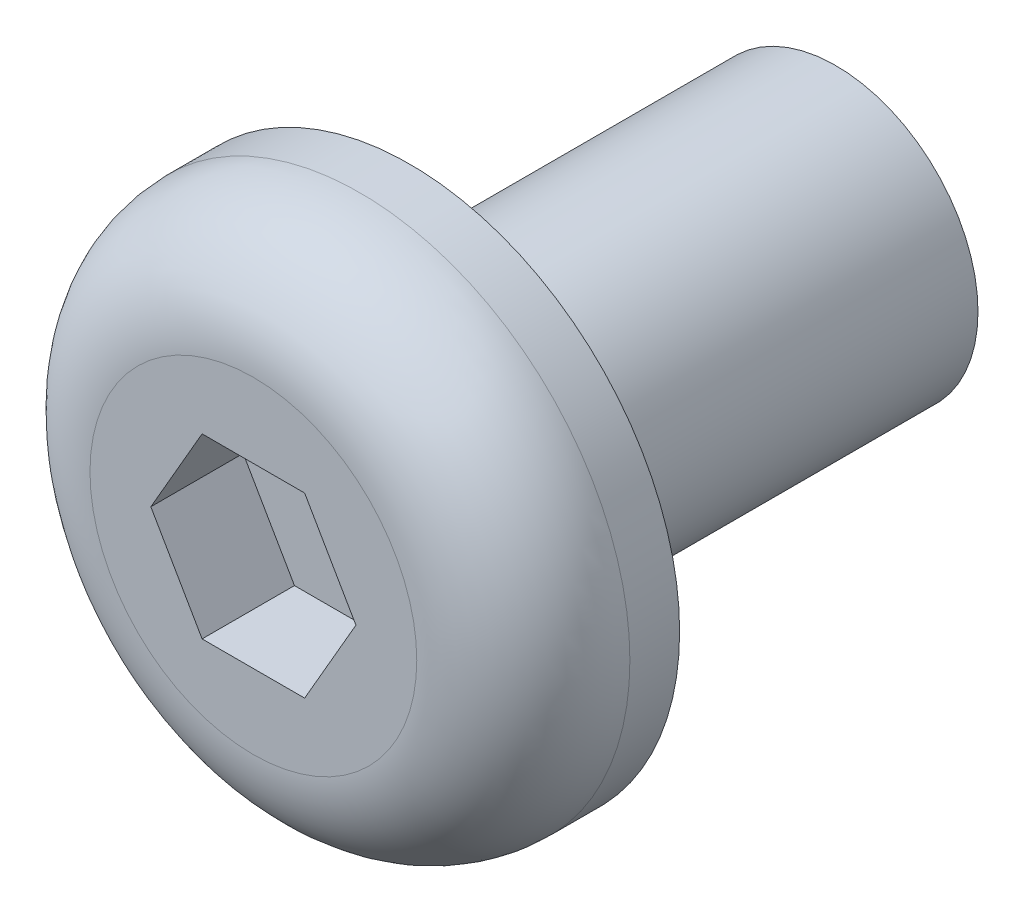
from build123d import *

# Parameters (mm, degrees)
SKETCH1_R      = 2
SHANK_DEPTH    = 6
SKETCH2_R      = 3.8
HEAD_DEPTH     = 2.2
BUTTON_ROUND_R = 1.5
SOCKET_DEPTH   = 1.3


with BuildPart() as part:
    # Sketch1 → Shank (new body)
    with BuildSketch(Plane.XY):
        Circle(SKETCH1_R)
    extrude(amount=SHANK_DEPTH)

    # Sketch2 → Head (add)
    with BuildSketch(Plane.XY.offset(6)):
        Circle(SKETCH2_R)
    extrude(amount=HEAD_DEPTH)

    # Button_round
    button_round_edges = [part.edges().sort_by_distance(p)[0] for p in [
        (-3.8, 0, 8.2),
    ]]
    fillet(button_round_edges, radius=BUTTON_ROUND_R)

    # Sketch3 → Socket (cut)
    with BuildSketch(Plane.XY.offset(6.9)):
        Polygon((1.443375673, 0), (0.721687836, 1.25), (-0.721687836, 1.25), (-1.443375673, 0), (-0.721687836, -1.25), (0.721687836, -1.25), align=None)
    extrude(amount=SOCKET_DEPTH, mode=Mode.SUBTRACT)


solid = part.part
